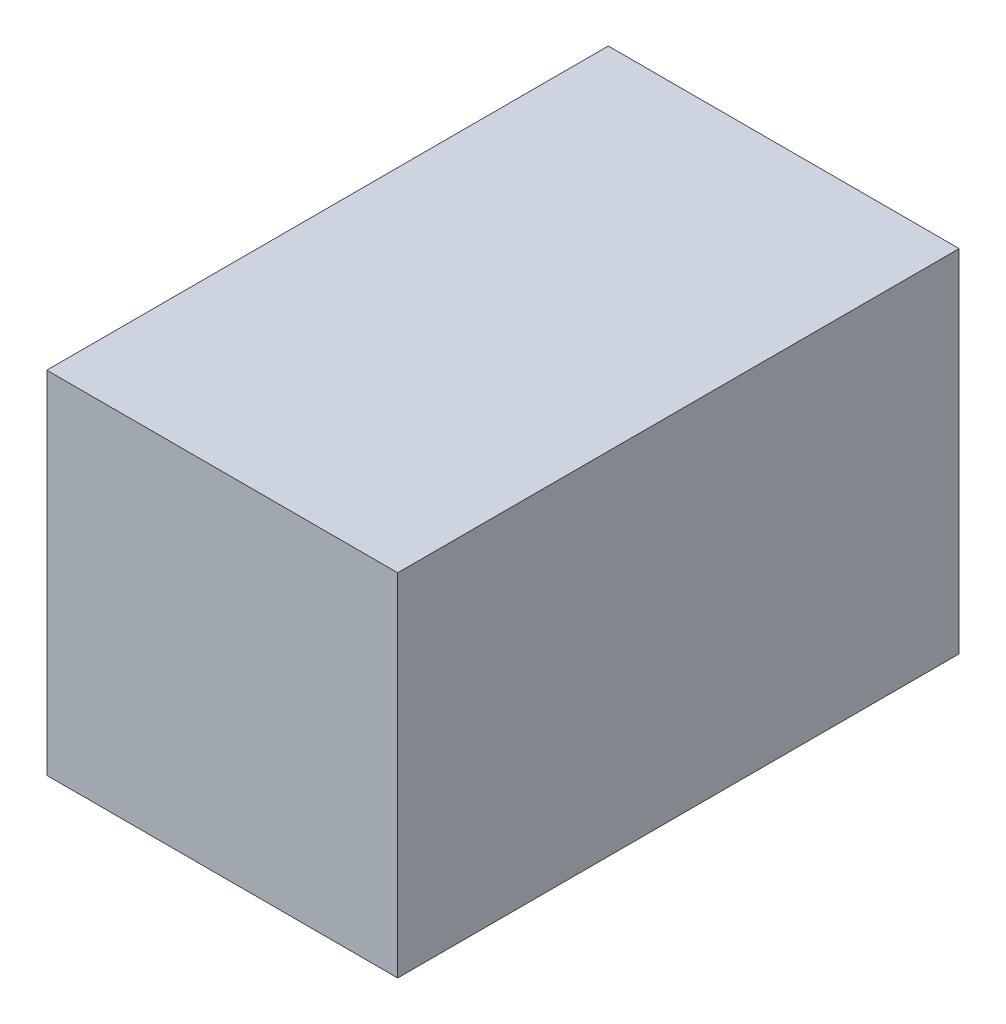
from build123d import *

# Parameters (mm, degrees)
SKETCH1_W           = 254
SKETCH1_H           = 254
BOSS_EXTRUDE1_DEPTH = 406.4


with BuildPart() as part:
    # Sketch1 → Boss-Extrude1 (new body)
    with BuildSketch(Plane.XY):
        Rectangle(SKETCH1_W, SKETCH1_H)
    extrude(amount=BOSS_EXTRUDE1_DEPTH)


solid = part.part
